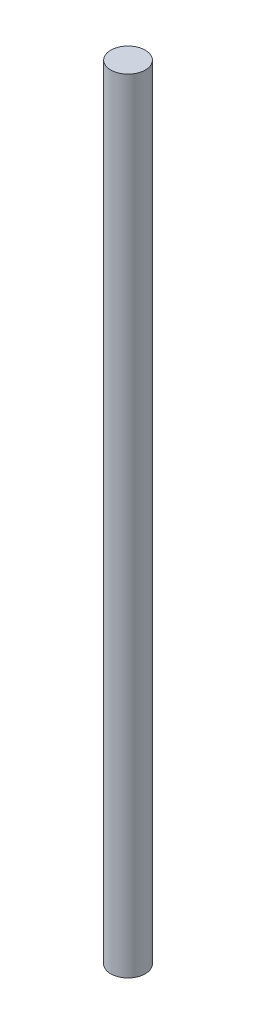
from build123d import *

# Parameters (mm, degrees)
SKETCH1_W = 1.3
SKETCH1_H = 59


with BuildPart() as part:
    # Sketch1 → Tendon (revolve)
    with BuildSketch(Plane.XY, mode=Mode.PRIVATE) as tendon_sk:
        with Locations((0.65, -29.5)):
            Rectangle(SKETCH1_W, SKETCH1_H)
    revolve(tendon_sk.sketch.rotate(Axis((0, -63, 0), (0, 1, 0)), 90), axis=Axis((0, -63, 0), (0, 1, 0)))


solid = part.part
